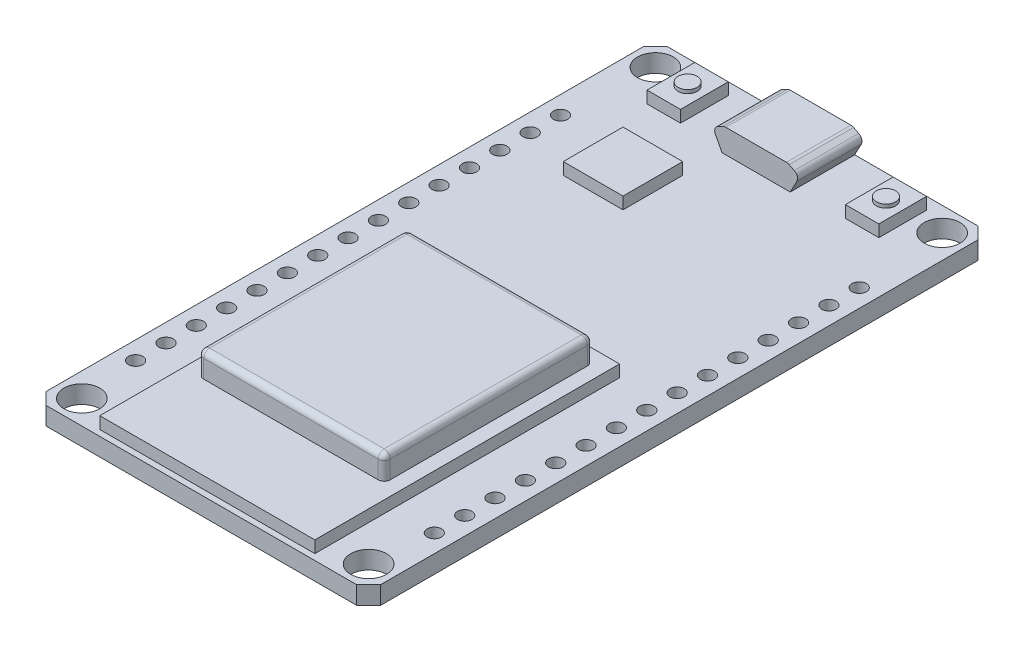
from build123d import *

# Parameters (mm, degrees)
ESBO_O2_R                = 1.5
RESSALTO_EXTRUS_O1_DEPTH = 1.5
ESBO_O3_W                = 18
ESBO_O3_H                = 25.5
RESSALTO_EXTRUS_O2_DEPTH = 1
ESBO_O4_W                = 15.6
ESBO_O4_H                = 17.5
RESSALTO_EXTRUS_O3_DEPTH = 2
ESBO_O5_W                = 5
ESBO_O5_H                = 5
ESBO_O5_W_2              = 2.8
ESBO_O5_H_2              = 4
RESSALTO_EXTRUS_O4_DEPTH = 1
ESBO_O6_R                = 0.8
RESSALTO_EXTRUS_O5_DEPTH = 0.3
RESSALTO_EXTRUS_O6_DEPTH = 5.4
ESBO_O8_W                = 7.643027542
ESBO_O8_H                = 2.610064774
CORTE_EXTRUS_O1_DEPTH    = 0.01
CORTE_EXTRUS_O2_DEPTH    = 5
ESBO_O11_R               = 0.6
CORTE_EXTRUS_O3_DEPTH    = 5
FILETE1_R                = 0.5


with BuildPart() as part:
    # Esboço2 → Ressalto-extrusão1 (new body)
    with BuildSketch(Plane(origin=(0, 0, 0), x_dir=(1, 0, 0), z_dir=(0, 1, 0))):
        Polygon((-14, -25), (-13, -26), (13, -26), (14, -25), (14, 25), (13, 26), (-13, 26), (-14, 25), align=None)
        with Locations(Location((-12, 24, 0), (0, 0, 270))):
            Circle(ESBO_O2_R, mode=Mode.SUBTRACT)
        with Locations(Location((12, 24, 0), (0, 0, 270))):
            Circle(ESBO_O2_R, mode=Mode.SUBTRACT)
        with Locations(Location((-12, -24, 0), (0, 0, 270))):
            Circle(ESBO_O2_R, mode=Mode.SUBTRACT)
        with Locations(Location((12, -24, 0), (0, 0, 270))):
            Circle(ESBO_O2_R, mode=Mode.SUBTRACT)
    extrude(amount=RESSALTO_EXTRUS_O1_DEPTH)

    # Esboço3 → Ressalto-extrusão2 (add)
    with BuildSketch(Plane(origin=(0, 1.5, 0), x_dir=(1, 0, 0), z_dir=(0, 1, 0))):
        with Locations((0, -12.75)):
            Rectangle(ESBO_O3_W, ESBO_O3_H)
    extrude(amount=RESSALTO_EXTRUS_O2_DEPTH)

    # Esboço4 → Ressalto-extrusão3 (add)
    with BuildSketch(Plane(origin=(0, 2.5, 0), x_dir=(1, 0, 0), z_dir=(0, 1, 0))):
        with Locations((0, -9.75)):
            Rectangle(ESBO_O4_W, ESBO_O4_H)
    extrude(amount=RESSALTO_EXTRUS_O3_DEPTH)

    # Esboço5 → Ressalto-extrusão4 (add)
    with BuildSketch(Plane(origin=(0, 1.5, 0), x_dir=(1, 0, 0), z_dir=(0, 1, 0))):
        with Locations((-5.523603775, 14.812859986)):
            Rectangle(ESBO_O5_W, ESBO_O5_H)
        with Locations((-8.3, 23)):
            Rectangle(ESBO_O5_W_2, ESBO_O5_H_2)
        with Locations((8.3, 23)):
            Rectangle(ESBO_O5_W_2, ESBO_O5_H_2)
    extrude(amount=RESSALTO_EXTRUS_O4_DEPTH)

    # Esboço6 → Ressalto-extrusão5 (add)
    with BuildSketch(Plane(origin=(0, 2.5, 0), x_dir=(1, 0, 0), z_dir=(0, 1, 0))):
        with Locations(Location((-8.3, 23, 0), (0, 0, 270))):
            Circle(ESBO_O6_R)
        with Locations(Location((8.3, 23, 0), (0, 0, 270))):
            Circle(ESBO_O6_R)
    extrude(amount=RESSALTO_EXTRUS_O5_DEPTH)

    # Esboço7 → Ressalto-extrusão6 (add)
    with BuildSketch(Plane(origin=(0, 0, -26), x_dir=(-1, 0, 0), z_dir=(0, 0, -1))):
        with BuildLine():
            Line((3.017267899, 1.5), (-2.682732101, 1.5))
            Line((-2.682732101, 1.5), (-3.241687067, 2.54804056))
            ThreePointArc((-3.241687067, 2.54804056), (-3.277055187, 2.934679492), (-3.025084898, 3.230063212))
            Line((-3.025084898, 3.230063212), (-2.594089093, 3.446728534))
            ThreePointArc((-2.594089093, 3.446728534), (-2.484917853, 3.48649988), (-2.369514792, 3.5))
            Line((-2.369514792, 3.5), (2.704050589, 3.5))
            ThreePointArc((2.704050589, 3.5), (2.81945365, 3.48649988), (2.928624891, 3.446728534))
            Line((2.928624891, 3.446728534), (3.359620695, 3.230063212))
            ThreePointArc((3.359620695, 3.230063212), (3.611590984, 2.934679492), (3.576222864, 2.54804056))
            Line((3.576222864, 2.54804056), (3.017267899, 1.5))
        make_face()
    extrude(amount=-RESSALTO_EXTRUS_O6_DEPTH)

    # Esboço8 → Corte-extrusão1 (cut)
    with BuildSketch(Plane(origin=(0, 0, -26), x_dir=(-1, 0, 0), z_dir=(0, 0, -1))):
        with Locations((-0.089109416, 2.805032387)):
            Rectangle(ESBO_O8_W, ESBO_O8_H)
    extrude(amount=-CORTE_EXTRUS_O1_DEPTH, mode=Mode.SUBTRACT)

    # Esboço10 → Corte-extrusão2 (cut)
    with BuildSketch(Plane(origin=(0, 0, -25.99), x_dir=(-1, 0, 0), z_dir=(0, 0, -1))):
        with BuildLine():
            Line((2.704050589, 3.1), (-2.369514792, 3.1))
            ThreePointArc((-2.369514792, 3.1), (-2.392595404, 3.097299976), (-2.414429652, 3.089345707))
            Line((-2.414429652, 3.089345707), (-2.845425456, 2.872680384))
            ThreePointArc((-2.845425456, 2.872680384), (-2.895819514, 2.813603641), (-2.88874589, 2.736275854))
            Line((-2.88874589, 2.736275854), (-2.442732101, 1.9))
            Line((-2.442732101, 1.9), (2.777267899, 1.9))
            Line((2.777267899, 1.9), (3.223281688, 2.736275854))
            ThreePointArc((3.223281688, 2.736275854), (3.230355312, 2.813603641), (3.179961254, 2.872680384))
            Line((3.179961254, 2.872680384), (2.748965449, 3.089345707))
            ThreePointArc((2.748965449, 3.089345707), (2.727131201, 3.097299976), (2.704050589, 3.1))
        make_face()
    extrude(amount=-CORTE_EXTRUS_O2_DEPTH, mode=Mode.SUBTRACT)

    # Esboço11 → Corte-extrusão3 (cut)
    with BuildSketch(Plane(origin=(0, 1.5, 0), x_dir=(1, 0, 0), z_dir=(0, 1, 0))):
        with Locations(Location((-12.5, 16.56, 0), (0, 0, 270))):
            Circle(ESBO_O11_R)
        with Locations(Location((-12.5, 14.02, 0), (0, 0, 270))):
            Circle(ESBO_O11_R)
        with Locations(Location((-12.5, 11.48, 0), (0, 0, 270))):
            Circle(ESBO_O11_R)
        with Locations(Location((-12.5, 8.94, 0), (0, 0, 270))):
            Circle(ESBO_O11_R)
        with Locations(Location((-12.5, 6.4, 0), (0, 0, 270))):
            Circle(ESBO_O11_R)
        with Locations(Location((-12.5, 3.86, 0), (0, 0, 270))):
            Circle(ESBO_O11_R)
        with Locations(Location((-12.5, 1.32, 0), (0, 0, 270))):
            Circle(ESBO_O11_R)
        with Locations(Location((-12.5, -1.22, 0), (0, 0, 270))):
            Circle(ESBO_O11_R)
        with Locations(Location((-12.5, -3.76, 0), (0, 0, 270))):
            Circle(ESBO_O11_R)
        with Locations(Location((-12.5, -6.3, 0), (0, 0, 270))):
            Circle(ESBO_O11_R)
        with Locations(Location((-12.5, -8.84, 0), (0, 0, 270))):
            Circle(ESBO_O11_R)
        with Locations(Location((-12.5, -11.38, 0), (0, 0, 270))):
            Circle(ESBO_O11_R)
        with Locations(Location((-12.5, -13.92, 0), (0, 0, 270))):
            Circle(ESBO_O11_R)
        with Locations(Location((-12.5, -16.46, 0), (0, 0, 270))):
            Circle(ESBO_O11_R)
        with Locations(Location((-12.5, -19, 0), (0, 0, 270))):
            Circle(ESBO_O11_R)
        with Locations(Location((12.5, -19, 0), (0, 0, 270))):
            Circle(ESBO_O11_R)
        with Locations(Location((12.5, -16.46, 0), (0, 0, 270))):
            Circle(ESBO_O11_R)
        with Locations(Location((12.5, -13.92, 0), (0, 0, 270))):
            Circle(ESBO_O11_R)
        with Locations(Location((12.5, -11.38, 0), (0, 0, 270))):
            Circle(ESBO_O11_R)
        with Locations(Location((12.5, -8.84, 0), (0, 0, 270))):
            Circle(ESBO_O11_R)
        with Locations(Location((12.5, -6.3, 0), (0, 0, 270))):
            Circle(ESBO_O11_R)
        with Locations(Location((12.5, -3.76, 0), (0, 0, 270))):
            Circle(ESBO_O11_R)
        with Locations(Location((12.5, -1.22, 0), (0, 0, 270))):
            Circle(ESBO_O11_R)
        with Locations(Location((12.5, 1.32, 0), (0, 0, 270))):
            Circle(ESBO_O11_R)
        with Locations(Location((12.5, 3.86, 0), (0, 0, 270))):
            Circle(ESBO_O11_R)
        with Locations(Location((12.5, 6.4, 0), (0, 0, 270))):
            Circle(ESBO_O11_R)
        with Locations(Location((12.5, 8.94, 0), (0, 0, 270))):
            Circle(ESBO_O11_R)
        with Locations(Location((12.5, 11.48, 0), (0, 0, 270))):
            Circle(ESBO_O11_R)
        with Locations(Location((12.5, 14.02, 0), (0, 0, 270))):
            Circle(ESBO_O11_R)
        with Locations(Location((12.5, 16.56, 0), (0, 0, 270))):
            Circle(ESBO_O11_R)
    extrude(amount=-CORTE_EXTRUS_O3_DEPTH, mode=Mode.SUBTRACT)

    # Filete1
    filete1_edges = [part.edges().sort_by_distance(p)[0] for p in [
        (7.8, 3.5, 18.5),
        (7.8, 3.5, 1),
        (-7.8, 3.5, 1),
        (-7.8, 3.5, 18.5),
        (7.8, 4.5, 9.75),
        (0, 4.5, 1),
        (-7.8, 4.5, 9.75),
        (0, 4.5, 18.5),
    ]]
    fillet(filete1_edges, radius=FILETE1_R)


solid = part.part
